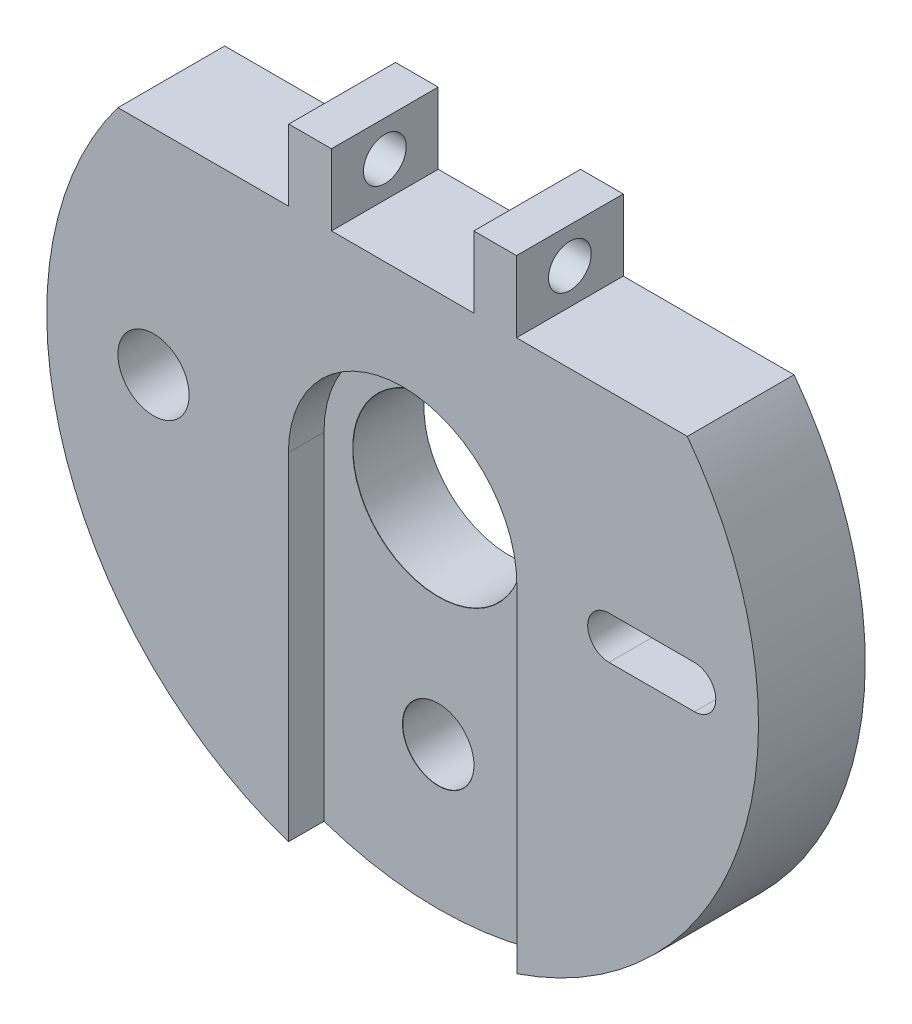
from build123d import *

# Parameters (mm, degrees)
ESTRUSIONE_ESTRUSIONE1_DEPTH = 15
TAGLIO_ESTRUSIONE1_DEPTH     = 5
TAGLIO_ESTRUSIONE2_REACH     = 74.284
FORO_6_0_6_1_D               = 6


with BuildPart() as part:
    # Schizzo1 → Estrusione-Estrusione1 (new body)
    with BuildSketch(Plane.XY):
        with BuildLine():
            Line((-40, 30), (-16, 30))
            Line((-16, 30), (-16, 40))
            Line((-16, 40), (-10, 40))
            Line((-10, 40), (-10, 30))
            Line((-10, 30), (10, 30))
            Line((10, 30), (10, 40))
            Line((10, 40), (16, 40))
            Line((16, 40), (16, 30))
            Line((16, 30), (40, 30))
            ThreePointArc((40, 30), (0, -50), (-40, 30))
        make_face()
    extrude(amount=ESTRUSIONE_ESTRUSIONE1_DEPTH)

    # Schizzo2 → Taglio-Estrusione1 (cut)
    with BuildSketch(Plane.XY.offset(15)):
        with BuildLine():
            Line((16.05, 0), (16.05, -60))
            ThreePointArc((16.05, -60), (0, -76.05), (-16.05, -60))
            Line((-16.05, -60), (-16.05, 0))
            ThreePointArc((-16.05, 0), (0, 16.05), (16.05, 0))
        make_face()
    extrude(amount=-TAGLIO_ESTRUSIONE1_DEPTH, mode=Mode.SUBTRACT)

    # Schizzo3 → Taglio-Estrusione2 (cut, up to next)
    with BuildSketch(Plane.XY.offset(15), mode=Mode.PRIVATE) as taglio_estrusione2_sk1:
        with BuildLine():
            Line((29, 3), (41, 3))
            ThreePointArc((41, 3), (44, 0), (41, -3))
            Line((41, -3), (29, -3))
            ThreePointArc((29, -3), (26, 0), (29, 3))
        make_face()
    taglio_estrusione2_tool1 = extrude(taglio_estrusione2_sk1.sketch, amount=-TAGLIO_ESTRUSIONE2_REACH, mode=Mode.PRIVATE) & part.part
    add(taglio_estrusione2_tool1.solids().sort_by_distance((35, 0, 15))[0], mode=Mode.SUBTRACT)

    # Schizzo4 → Foro Ø24.0 (24)-1 (revolve, cut)
    with BuildSketch(Plane(origin=(0, 0, 10), x_dir=(0, -1, 0), z_dir=(1, 0, 0))):
        Polygon((0, 0), (0, 10.001), (12, 10.001), (12, 0.025), (12.025, 0), align=None)
    revolve(axis=Axis((0, 0, 16.35), (0, 0, -1)), mode=Mode.SUBTRACT)

    # Schizzo5 → Foro Ø10.0 (10)-1 (revolve, cut)
    with BuildSketch(Plane(origin=(0, -30, 10), x_dir=(0, -1, 0), z_dir=(1, 0, 0))):
        Polygon((0, 0), (0, 10.001), (5, 10.001), (5, 0.025), (5.025, 0), align=None)
    revolve(axis=Axis((0, -30, 16.35), (0, 0, -1)), mode=Mode.SUBTRACT)

    # Schizzo6 → Foro lamato per Bullone M5 a testa esagonale-1 (revolve, cut)
    with BuildSketch(Plane(origin=(-35, 0, 15), x_dir=(0, -1, 0), z_dir=(1, 0, 0))):
        Polygon((0, 0), (0, 15.001), (3.5, 15.001), (3.5, 10), (5, 10), (5, 0), align=None)
    revolve(axis=Axis((-35, 0, 21.35), (0, 0, -1)), mode=Mode.SUBTRACT)

    # Foro Ø6.0 (6)-1 (through all)
    with Locations(Plane(origin=(-16, 35, 7.5), x_dir=(0, 0, -1), z_dir=(-1, 0, 0))):
        with Locations((0, 0)):
            Hole(FORO_6_0_6_1_D / 2)


solid = part.part
